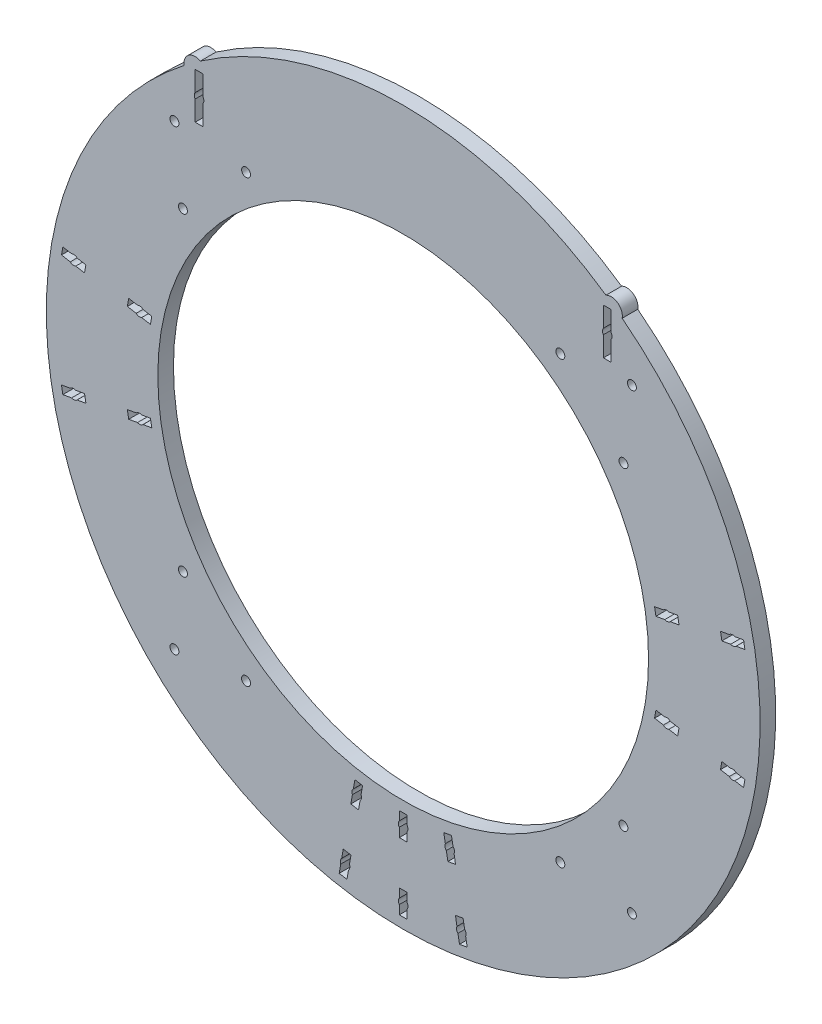
from build123d import *

# Parameters (mm, degrees)
SKETCH_1_R               = 160
SKETCH_1_R_2             = 110
EXTRUDE_1_DEPTH          = 3.5
CUT_EXTRUDE_1_DEPTH      = 227.301237292
CUT_EXTRUDE_1_DEPTH_BACK = 227.301237292
CUT_EXTRUDE_2_DEPTH      = 227.382419812
CUT_EXTRUDE_2_DEPTH_BACK = 227.382419812
SKETCH_3_R               = 2
CUT_EXTRUDE_3_DEPTH      = 227.382419812
CUT_EXTRUDE_3_DEPTH_BACK = 227.382419812
SKETCH_4_R               = 2.15
SKETCH_4_W               = 3.5
SKETCH_4_H               = 20.5
EXTRUDE_2_DEPTH          = 7


with BuildPart() as part:
    # 草图1 → 凸台-拉伸1 (new, symmetric)
    with BuildSketch(Plane.XY):
        Circle(SKETCH_1_R)
        Circle(SKETCH_1_R_2, mode=Mode.SUBTRACT)
    extrude(amount=EXTRUDE_1_DEPTH, both=True)

    # 草图2 → 切除-拉伸1 (cut, two sides: drawn at the far end of the back side and taken through both)
    with BuildSketch(Plane.XY.offset(-CUT_EXTRUDE_1_DEPTH_BACK)):
        with BuildLine():
            Line((-27.553753713, -146.187254152), (-26.858987285, -142.247037938))
            Line((-26.858987285, -142.247037938), (-23.41216015, -142.854806559))
            Line((-23.41216015, -142.854806559), (-24.106926578, -146.795022773))
            ThreePointArc((-24.106926578, -146.795022773), (-23.929889981, -148.094506534), (-24.540699587, -149.255071752))
            Line((-24.540699587, -149.255071752), (-25.235466015, -153.195287966))
            Line((-25.235466015, -153.195287966), (-28.682293151, -152.587519344))
            Line((-28.682293151, -152.587519344), (-27.987526722, -148.64730313))
            ThreePointArc((-27.987526722, -148.64730313), (-28.164563319, -147.34781937), (-27.553753713, -146.187254152))
        make_face()
        with BuildLine():
            Line((1.75, -125.25), (1.75, -121.2489996))
            ThreePointArc((1.75, -121.2489996), (2.15, -120), (1.75, -118.7510004))
            Line((1.75, -118.7510004), (1.75, -114.75))
            Line((1.75, -114.75), (-1.75, -114.75))
            Line((-1.75, -114.75), (-1.75, -118.7510004))
            ThreePointArc((-1.75, -118.7510004), (-2.15, -120), (-1.75, -121.2489996))
            Line((-1.75, -121.2489996), (-1.75, -125.25))
            Line((-1.75, -125.25), (1.75, -125.25))
        make_face()
        with BuildLine():
            Line((-1.75, -148.7510004), (-1.75, -144.75))
            Line((-1.75, -144.75), (1.75, -144.75))
            Line((1.75, -144.75), (1.75, -148.7510004))
            ThreePointArc((1.75, -148.7510004), (2.15, -150), (1.75, -151.2489996))
            Line((1.75, -151.2489996), (1.75, -155.25))
            Line((1.75, -155.25), (-1.75, -155.25))
            Line((-1.75, -155.25), (-1.75, -151.2489996))
            ThreePointArc((-1.75, -151.2489996), (-2.15, -150), (-1.75, -148.7510004))
        make_face()
        with BuildLine():
            ThreePointArc((24.540699587, -149.255071752), (23.929889981, -148.094506534), (24.106926578, -146.795022773))
            Line((24.106926578, -146.795022773), (23.41216015, -142.854806559))
            Line((23.41216015, -142.854806559), (26.858987285, -142.247037938))
            Line((26.858987285, -142.247037938), (27.553753713, -146.187254152))
            ThreePointArc((27.553753713, -146.187254152), (28.164563319, -147.34781937), (27.987526722, -148.64730313))
            Line((27.987526722, -148.64730313), (28.682293151, -152.587519344))
            Line((28.682293151, -152.587519344), (25.235466015, -153.195287966))
            Line((25.235466015, -153.195287966), (24.540699587, -149.255071752))
        make_face()
        with BuildLine():
            Line((146.187254152, -27.553753713), (142.247037938, -26.858987285))
            Line((142.247037938, -26.858987285), (142.854806559, -23.41216015))
            Line((142.854806559, -23.41216015), (146.795022773, -24.106926578))
            ThreePointArc((146.795022773, -24.106926578), (148.094506534, -23.929889981), (149.255071752, -24.540699587))
            Line((149.255071752, -24.540699587), (153.195287966, -25.235466015))
            Line((153.195287966, -25.235466015), (152.587519344, -28.682293151))
            Line((152.587519344, -28.682293151), (148.64730313, -27.987526722))
            ThreePointArc((148.64730313, -27.987526722), (147.34781937, -28.164563319), (146.187254152, -27.553753713))
        make_face()
        with BuildLine():
            Line((123.651055376, -20.026020685), (119.710839162, -19.331254257))
            ThreePointArc((119.710839162, -19.331254257), (118.550273943, -18.720444651), (117.250790183, -18.897481248))
            Line((117.250790183, -18.897481248), (113.310573969, -18.20271482))
            Line((113.310573969, -18.20271482), (112.702805347, -21.649541955))
            Line((112.702805347, -21.649541955), (116.643021561, -22.344308383))
            ThreePointArc((116.643021561, -22.344308383), (117.803586779, -22.955117989), (119.10307054, -22.778081392))
            Line((119.10307054, -22.778081392), (123.043286754, -23.472847821))
            Line((123.043286754, -23.472847821), (123.651055376, -20.026020685))
        make_face()
        with BuildLine():
            ThreePointArc((149.255071752, 24.540699587), (148.094506534, 23.929889981), (146.795022773, 24.106926578))
            Line((146.795022773, 24.106926578), (142.854806559, 23.41216015))
            Line((142.854806559, 23.41216015), (142.247037938, 26.858987285))
            Line((142.247037938, 26.858987285), (146.187254152, 27.553753713))
            ThreePointArc((146.187254152, 27.553753713), (147.34781937, 28.164563319), (148.64730313, 27.987526722))
            Line((148.64730313, 27.987526722), (152.587519344, 28.682293151))
            Line((152.587519344, 28.682293151), (153.195287966, 25.235466015))
            Line((153.195287966, 25.235466015), (149.255071752, 24.540699587))
        make_face()
        with BuildLine():
            ThreePointArc((116.643021561, 22.344308383), (117.803586779, 22.955117989), (119.10307054, 22.778081392))
            Line((119.10307054, 22.778081392), (123.043286754, 23.472847821))
            Line((123.043286754, 23.472847821), (123.651055376, 20.026020685))
            Line((123.651055376, 20.026020685), (119.710839162, 19.331254257))
            ThreePointArc((119.710839162, 19.331254257), (118.550273943, 18.720444651), (117.250790183, 18.897481248))
            Line((117.250790183, 18.897481248), (113.310573969, 18.20271482))
            Line((113.310573969, 18.20271482), (112.702805347, 21.649541955))
            Line((112.702805347, 21.649541955), (116.643021561, 22.344308383))
        make_face()
        with BuildLine():
            ThreePointArc((-149.255071752, -24.540699587), (-148.094506534, -23.929889981), (-146.795022773, -24.106926578))
            Line((-146.795022773, -24.106926578), (-142.854806559, -23.41216015))
            Line((-142.854806559, -23.41216015), (-142.247037938, -26.858987285))
            Line((-142.247037938, -26.858987285), (-146.187254152, -27.553753713))
            ThreePointArc((-146.187254152, -27.553753713), (-147.34781937, -28.164563319), (-148.64730313, -27.987526722))
            Line((-148.64730313, -27.987526722), (-152.587519344, -28.682293151))
            Line((-152.587519344, -28.682293151), (-153.195287966, -25.235466015))
            Line((-153.195287966, -25.235466015), (-149.255071752, -24.540699587))
        make_face()
        with BuildLine():
            ThreePointArc((-116.643021561, -22.344308383), (-117.803586779, -22.955117989), (-119.10307054, -22.778081392))
            Line((-119.10307054, -22.778081392), (-123.043286754, -23.472847821))
            Line((-123.043286754, -23.472847821), (-123.651055376, -20.026020685))
            Line((-123.651055376, -20.026020685), (-119.710839162, -19.331254257))
            ThreePointArc((-119.710839162, -19.331254257), (-118.550273943, -18.720444651), (-117.250790183, -18.897481248))
            Line((-117.250790183, -18.897481248), (-113.310573969, -18.20271482))
            Line((-113.310573969, -18.20271482), (-112.702805347, -21.649541955))
            Line((-112.702805347, -21.649541955), (-116.643021561, -22.344308383))
        make_face()
        with BuildLine():
            Line((-123.651055376, 20.026020685), (-119.710839162, 19.331254257))
            ThreePointArc((-119.710839162, 19.331254257), (-118.550273943, 18.720444651), (-117.250790183, 18.897481248))
            Line((-117.250790183, 18.897481248), (-113.310573969, 18.20271482))
            Line((-113.310573969, 18.20271482), (-112.702805347, 21.649541955))
            Line((-112.702805347, 21.649541955), (-116.643021561, 22.344308383))
            ThreePointArc((-116.643021561, 22.344308383), (-117.803586779, 22.955117989), (-119.10307054, 22.778081392))
            Line((-119.10307054, 22.778081392), (-123.043286754, 23.472847821))
            Line((-123.043286754, 23.472847821), (-123.651055376, 20.026020685))
        make_face()
        with BuildLine():
            Line((-23.472847821, -123.043286754), (-22.778081392, -119.10307054))
            ThreePointArc((-22.778081392, -119.10307054), (-22.955117989, -117.803586779), (-22.344308383, -116.643021561))
            Line((-22.344308383, -116.643021561), (-21.649541955, -112.702805347))
            Line((-21.649541955, -112.702805347), (-18.20271482, -113.310573969))
            Line((-18.20271482, -113.310573969), (-18.897481248, -117.250790183))
            ThreePointArc((-18.897481248, -117.250790183), (-18.720444651, -118.550273943), (-19.331254257, -119.710839162))
            Line((-19.331254257, -119.710839162), (-20.026020685, -123.651055376))
            Line((-20.026020685, -123.651055376), (-23.472847821, -123.043286754))
        make_face()
        with BuildLine():
            Line((23.472847821, -123.043286754), (22.778081392, -119.10307054))
            ThreePointArc((22.778081392, -119.10307054), (22.955117989, -117.803586779), (22.344308383, -116.643021561))
            Line((22.344308383, -116.643021561), (21.649541955, -112.702805347))
            Line((21.649541955, -112.702805347), (18.20271482, -113.310573969))
            Line((18.20271482, -113.310573969), (18.897481248, -117.250790183))
            ThreePointArc((18.897481248, -117.250790183), (18.720444651, -118.550273943), (19.331254257, -119.710839162))
            Line((19.331254257, -119.710839162), (20.026020685, -123.651055376))
            Line((20.026020685, -123.651055376), (23.472847821, -123.043286754))
        make_face()
        with BuildLine():
            Line((-146.187254152, 27.553753713), (-142.247037938, 26.858987285))
            Line((-142.247037938, 26.858987285), (-142.854806559, 23.41216015))
            Line((-142.854806559, 23.41216015), (-146.795022773, 24.106926578))
            ThreePointArc((-146.795022773, 24.106926578), (-148.094506534, 23.929889981), (-149.255071752, 24.540699587))
            Line((-149.255071752, 24.540699587), (-153.195287966, 25.235466015))
            Line((-153.195287966, 25.235466015), (-152.587519344, 28.682293151))
            Line((-152.587519344, 28.682293151), (-148.64730313, 27.987526722))
            ThreePointArc((-148.64730313, 27.987526722), (-147.34781937, 28.164563319), (-146.187254152, 27.553753713))
        make_face()
    extrude(amount=CUT_EXTRUDE_1_DEPTH + CUT_EXTRUDE_1_DEPTH_BACK, mode=Mode.SUBTRACT)

    # 草图3 → 切除-拉伸2 (cut, two sides: drawn at the far end of the back side and taken through both)
    with BuildSketch(Plane.XY.offset(3.5).offset(-CUT_EXTRUDE_2_DEPTH_BACK)):
        with Locations((-102.530483272, 102.530483272)):
            Circle(SKETCH_3_R)
        with Locations((-70.453928158, 98.738199405)):
            Circle(SKETCH_3_R)
        with Locations((-98.738199405, 70.453928157)):
            Circle(SKETCH_3_R)
        with Locations((102.530483272, 102.530483272)):
            Circle(SKETCH_3_R)
        with Locations((98.738199405, 70.453928158)):
            Circle(SKETCH_3_R)
        with Locations((70.453928157, 98.738199405)):
            Circle(SKETCH_3_R)
        with Locations((102.530483272, -102.530483272)):
            Circle(SKETCH_3_R)
        with Locations((70.453928158, -98.738199405)):
            Circle(SKETCH_3_R)
        with Locations((98.738199405, -70.453928157)):
            Circle(SKETCH_3_R)
        with Locations((-102.530483272, -102.530483272)):
            Circle(SKETCH_3_R)
        with Locations((-98.738199405, -70.453928158)):
            Circle(SKETCH_3_R)
        with Locations((-70.453928157, -98.738199405)):
            Circle(SKETCH_3_R)
    extrude(amount=CUT_EXTRUDE_2_DEPTH + CUT_EXTRUDE_2_DEPTH_BACK, mode=Mode.SUBTRACT)

    # 草图4 → 切除-拉伸3 (cut, two sides: drawn at the far end of the back side and taken through both)
    with BuildSketch(Plane(origin=(0, 0, -3.5), x_dir=(-1, 0, 0), z_dir=(0, 0, -1)).offset(-CUT_EXTRUDE_3_DEPTH_BACK)):
        with Locations((-91.5, 117)):
            Circle(SKETCH_4_R)
        with Locations((91.5, 117)):
            Circle(SKETCH_4_R)
        with Locations((91.5, 117)):
            Rectangle(SKETCH_4_W, SKETCH_4_H)
        with Locations((-91.5, 117)):
            Rectangle(SKETCH_4_W, SKETCH_4_H)
    extrude(amount=CUT_EXTRUDE_3_DEPTH + CUT_EXTRUDE_3_DEPTH_BACK, mode=Mode.SUBTRACT)

    # 草图5 → 凸台-拉伸2 (add)
    with BuildSketch(Plane.XY.offset(3.5)):
        with BuildLine():
            ThreePointArc((-90.906081554, 131.666564991), (-96.205444139, 131.283032351), (-98.167478879, 126.345344554))
            ThreePointArc((-98.167478879, 126.345344554), (-94.574212449, 129.057035219), (-90.906081554, 131.666564991))
        make_face()
        with BuildLine():
            ThreePointArc((98.167478879, 126.345344554), (96.205444139, 131.283032351), (90.906081554, 131.666564991))
            ThreePointArc((90.906081554, 131.666564991), (94.574212449, 129.057035219), (98.167478879, 126.345344554))
        make_face()
    extrude(amount=-EXTRUDE_2_DEPTH)


solid = part.part
